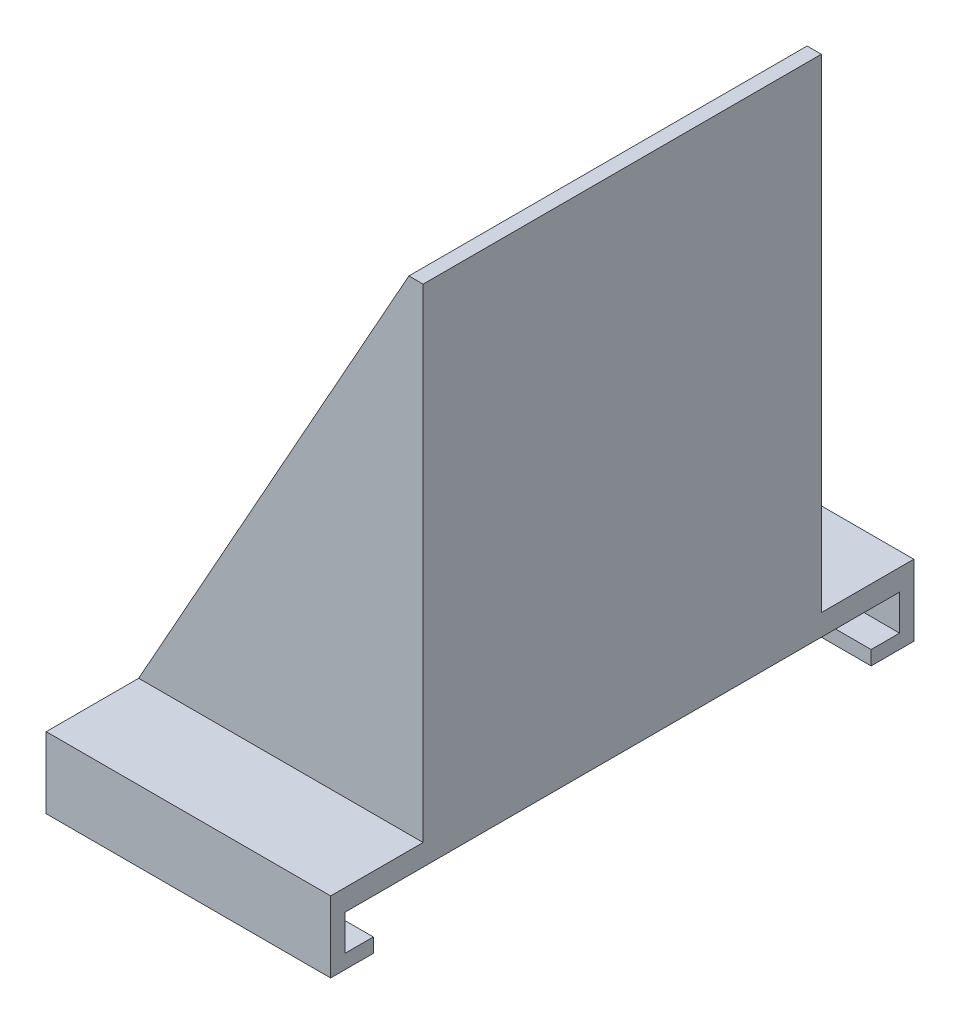
from build123d import *

# Parameters (mm, degrees)
CROQUIS1_W              = 20
CROQUIS1_H              = 41
SALIENTE_EXTRUIR1_DEPTH = 1.5
SALIENTE_EXTRUIR3_DEPTH = 20
CROQUIS4_W              = 28
CROQUIS4_H              = 34
SALIENTE_EXTRUIR4_DEPTH = 1
SALIENTE_EXTRUIR5_DEPTH = 1
SALIENTE_EXTRUIR6_DEPTH = 1
SALIENTE_EXTRUIR7_DEPTH = 28


with BuildPart() as part:
    # Croquis1 → Saliente-Extruir1 (new body)
    with BuildSketch(Plane(origin=(0, 0, 0), x_dir=(1, 0, 0), z_dir=(0, 1, 0))):
        with Locations((42.14893617, 2.677304965)):
            Rectangle(CROQUIS1_W, CROQUIS1_H)
    extrude(amount=SALIENTE_EXTRUIR1_DEPTH)

    # Croquis3 → Saliente-Extruir3 (add)
    with BuildSketch(Plane(origin=(52.14893617, 0, 0), x_dir=(0, 0, -1), z_dir=(1, 0, 0))):
        Polygon((-17.822695035, 0), (-17.822695035, -3.5), (-14.822695035, -3.5), (-14.822695035, -2.5), (-16.822695035, -2.5), (-16.822695035, 0), align=None)
        Polygon((22.177304965, -2.5), (22.177304965, 0), (23.177304965, 0), (23.177304965, -3.5), (20.177304965, -3.5), (20.177304965, -2.5), align=None)
    extrude(amount=-SALIENTE_EXTRUIR3_DEPTH)

    # Croquis4 → Saliente-Extruir4 (add)
    with BuildSketch(Plane(origin=(52.14893617, 0, 0), x_dir=(0, 0, -1), z_dir=(1, 0, 0))):
        with Locations((2.677304965, 18.5)):
            Rectangle(CROQUIS4_W, CROQUIS4_H)
    extrude(amount=-SALIENTE_EXTRUIR4_DEPTH)

    # Croquis5 → Saliente-Extruir5 (add)
    with BuildSketch(Plane.XY.offset(11.322695035)):
        Polygon((51.14893617, 35.5), (32.14893617, 1.5), (51.14893617, 1.5), align=None)
    extrude(amount=-SALIENTE_EXTRUIR5_DEPTH)

    # Croquis6 → Saliente-Extruir6 (add)
    with BuildSketch(Plane(origin=(0, 0, -16.677304965), x_dir=(-1, 0, 0), z_dir=(0, 0, -1))):
        Polygon((-51.14893617, 35.5), (-32.14893617, 1.5), (-51.14893617, 1.5), align=None)
    extrude(amount=-SALIENTE_EXTRUIR6_DEPTH)

    # Croquis7 → Saliente-Extruir7 (add)
    with BuildSketch(Plane.XY.offset(11.322695035)):
        Polygon((52.14893617, 1.5), (52.14893617, 3.5), (33.266583229, 3.5), (32.14893617, 1.5), align=None)
    extrude(amount=-SALIENTE_EXTRUIR7_DEPTH)


solid = part.part
